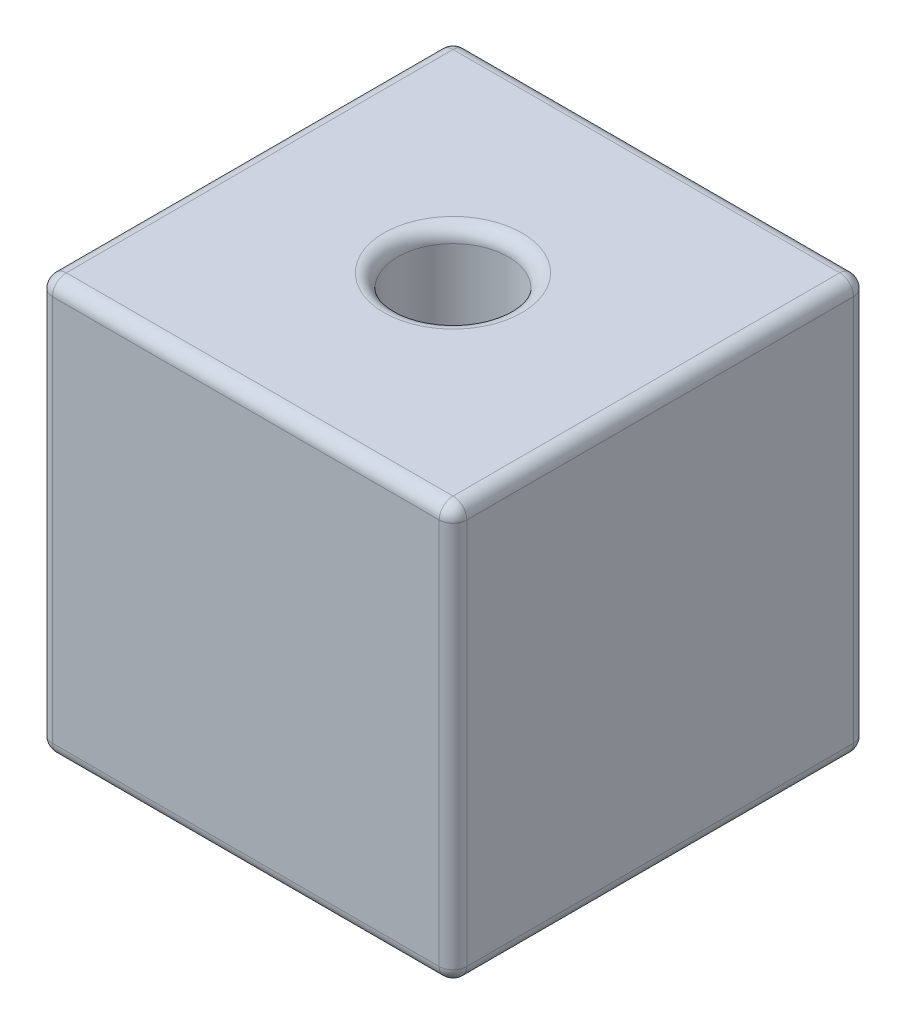
from build123d import *

# Parameters (mm, degrees)
SKIZZE1_W                       = 30
SKIZZE1_H                       = 30
AUFSATZ_LINEAR_AUSTRAGEN1_DEPTH = 30
SKIZZE2_R                       = 4
SCHNITT_LINEAR_AUSTRAGEN1_DEPTH = 31
VERRUNDUNG1_R                   = 1


with BuildPart() as part:
    # Skizze1 → Aufsatz-Linear austragen1 (new body)
    with BuildSketch(Plane(origin=(0, 0, 0), x_dir=(1, 0, 0), z_dir=(0, 1, 0))):
        Rectangle(SKIZZE1_W, SKIZZE1_H)
    extrude(amount=AUFSATZ_LINEAR_AUSTRAGEN1_DEPTH)

    # Skizze2 → Schnitt-Linear austragen1 (cut)
    with BuildSketch(Plane(origin=(0, 30, 0), x_dir=(1, 0, 0), z_dir=(0, 1, 0))):
        with Locations(Location((0, 0, 0), (0, 0, 270))):
            Circle(SKIZZE2_R)
    extrude(amount=-SCHNITT_LINEAR_AUSTRAGEN1_DEPTH, mode=Mode.SUBTRACT)

    # Verrundung1
    verrundung1_edges = [part.edges().sort_by_distance(p)[0] for p in [
        (-15, 30, 0),
        (0, 0, -4),
        (0, 30, -4),
        (0, 30, 15),
        (15, 30, 0),
        (0, 0, 15),
        (-15, 0, 0),
        (0, 0, -15),
        (15, 0, 0),
        (15, 15, 15),
        (-15, 15, 15),
        (-15, 15, -15),
        (15, 15, -15),
        (0, 30, -15),
    ]]
    fillet(verrundung1_edges, radius=VERRUNDUNG1_R)


solid = part.part
